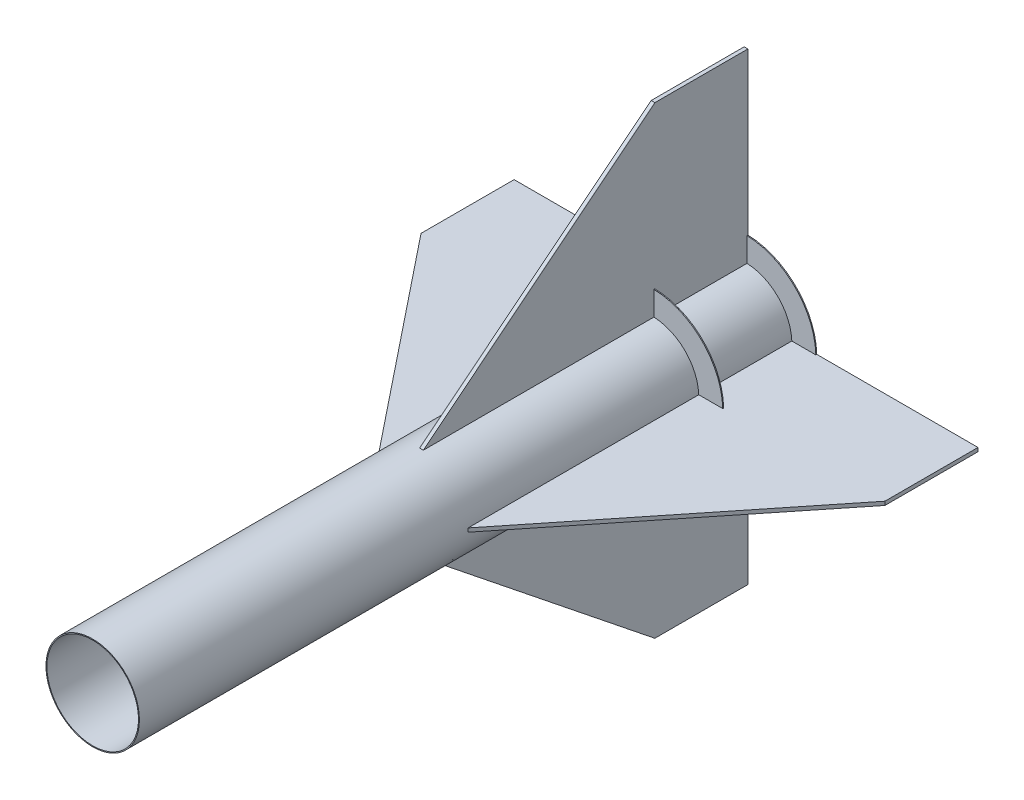
from build123d import *

# Parameters (mm, degrees)
SKETCH3_R           = 50.2125
SKETCH3_R_2         = 49.2125
BOSS_EXTRUDE1_DEPTH = 702
SKETCH4_R           = 76
SKETCH4_R_2         = 49.2125
BOSS_EXTRUDE2_DEPTH = 1
SKETCH5_R           = 76
BOSS_EXTRUDE3_DEPTH = 1
BOSS_EXTRUDE4_DEPTH = 2
CIRPATTERN1_COUNT   = 4


with BuildPart() as part:
    # Sketch3 → Boss-Extrude1 (new body)
    with BuildSketch(Plane.XY):
        Circle(SKETCH3_R)
        Circle(SKETCH3_R_2, mode=Mode.SUBTRACT)
    extrude(amount=BOSS_EXTRUDE1_DEPTH)

    # Sketch4 → Boss-Extrude2 (add)
    with BuildSketch(Plane(origin=(0, 0, 0), x_dir=(-1, 0, 0), z_dir=(0, 0, -1))):
        Circle(SKETCH4_R)
        Circle(SKETCH4_R_2, mode=Mode.SUBTRACT)
    extrude(amount=-BOSS_EXTRUDE2_DEPTH)

    # Sketch5 → Boss-Extrude3 (add)
    with BuildSketch(Plane(origin=(0, 0, 100), x_dir=(-1, 0, 0), z_dir=(0, 0, -1))):
        Circle(SKETCH5_R)
    extrude(amount=-BOSS_EXTRUDE3_DEPTH)

    # Sketch6 → Boss-Extrude4 (add, symmetric)
    with BuildSketch(Plane(origin=(0, 0, 0), x_dir=(1, 0, 0), z_dir=(0, 1, 0))):
        Polygon((-49.2125, 0), (-49.2125, -350), (-249.2125, -100), (-249.2125, 0), align=None)
    boss_extrude4 = extrude(amount=BOSS_EXTRUDE4_DEPTH, both=True)

    # CirPattern1: Boss-Extrude4 ×4 about axis
    cirpattern1_axis = Axis((0, 0, 702), (0, 0, -1))
    for i in range(1, CIRPATTERN1_COUNT):
        add(boss_extrude4.rotate(cirpattern1_axis, i * 360 / CIRPATTERN1_COUNT))


solid = part.part
